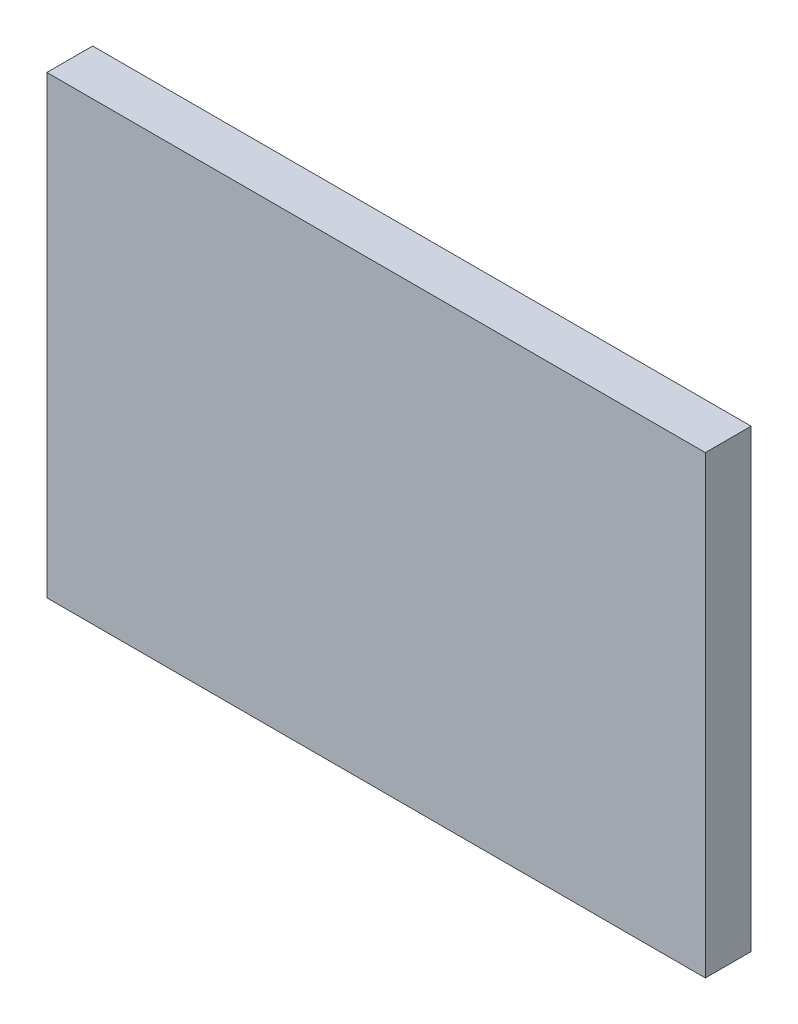
from build123d import *

# Parameters (mm, degrees)
SKETCH1_W           = 36.524447976
SKETCH1_H           = 25.238803938
BOSS_EXTRUDE1_DEPTH = 2.54


with BuildPart() as part:
    # Sketch1 → Boss-Extrude1 (new body)
    with BuildSketch(Plane.XY):
        with Locations((-0.51298382, 5.745418783)):
            Rectangle(SKETCH1_W, SKETCH1_H)
    extrude(amount=BOSS_EXTRUDE1_DEPTH)


solid = part.part
